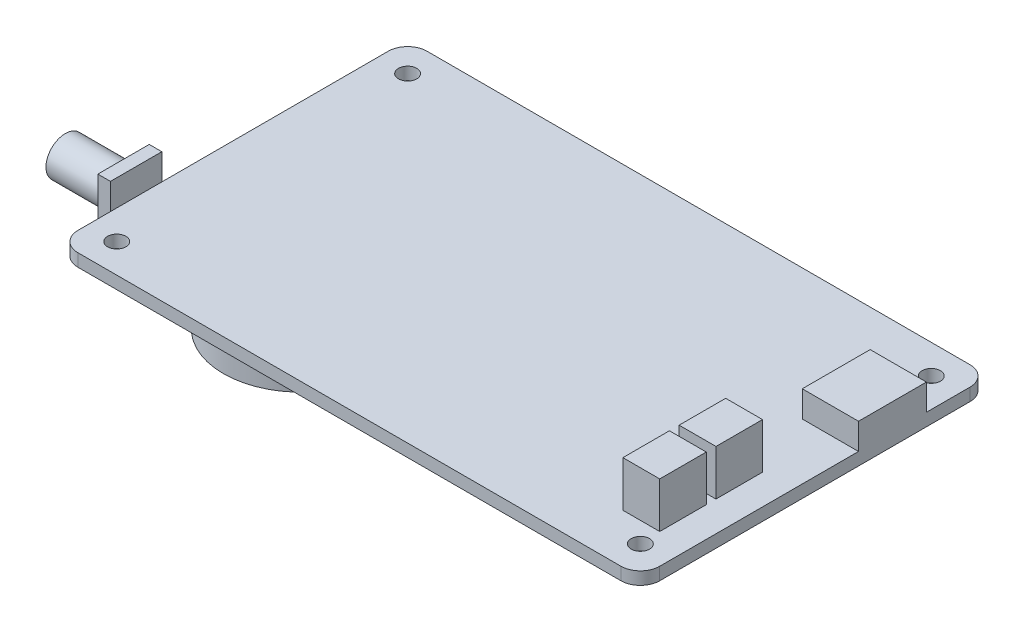
from build123d import *

# Parameters (mm, degrees)
SKETCH1_W                = 76.2
SKETCH1_H                = 45.72
BOSS_EXTRUDE1_DEPTH      = 0.8255
SKETCH2_R                = 10.16
BOSS_EXTRUDE2_DEPTH      = 5.08
SKETCH3_W                = 6.731
SKETCH3_H                = 6.858
BOSS_EXTRUDE3_DEPTH      = 1.651
SKETCH4_R                = 2.54
BOSS_EXTRUDE4_DEPTH      = 7.62
BOSS_EXTRUDE5_DEPTH      = 5.969
BOSS_EXTRUDE5_DEPTH_BACK = 2.54
SKETCH5_W                = 4.826
SKETCH5_H                = 6.096
SKETCH6_W                = 7.366
SKETCH6_H                = 8.89
BOSS_EXTRUDE6_DEPTH      = 3.429
M2_CLEARANCE_HOLE1_D     = 2.4
FILLET1_R                = 2.54


with BuildPart() as part:
    # Sketch1 → Boss-Extrude1 (new, symmetric)
    with BuildSketch(Plane(origin=(0, 0, 0), x_dir=(1, 0, 0), z_dir=(0, 1, 0))):
        Rectangle(SKETCH1_W, SKETCH1_H)
    extrude(amount=BOSS_EXTRUDE1_DEPTH, both=True)

    # Sketch2 → Boss-Extrude2 (add)
    with BuildSketch(Plane.XZ.offset(0.8255)):
        with Locations(Location((-19.05, 10.16, 0), (0, 0, 90))):
            Circle(SKETCH2_R)
    extrude(amount=BOSS_EXTRUDE2_DEPTH)

    # Sketch3 → Boss-Extrude3 (add)
    with BuildSketch(Plane.ZY.offset(38.1)):
        with Locations((12.7, 0.8255)):
            Rectangle(SKETCH3_W, SKETCH3_H)
    extrude(amount=BOSS_EXTRUDE3_DEPTH)

    # Sketch4 → Boss-Extrude4 (add)
    with BuildSketch(Plane.ZY.offset(39.751)):
        with Locations(Location((12.7, 0.8255, 0), (0, 0, 180))):
            Circle(SKETCH4_R)
    extrude(amount=BOSS_EXTRUDE4_DEPTH)

    # Sketch5 → Boss-Extrude5 (add, two sides: drawn at the far end of the back side and taken through both)
    with BuildSketch(Plane(origin=(0, 0.8255, 0), x_dir=(1, 0, 0), z_dir=(0, 1, 0)).offset(-BOSS_EXTRUDE5_DEPTH_BACK)):
        with Locations((31.75, -13.335)):
            Rectangle(SKETCH5_W, SKETCH5_H)
        with Locations((31.75, -5.969)):
            Rectangle(SKETCH5_W, SKETCH5_H)
    extrude(amount=BOSS_EXTRUDE5_DEPTH + BOSS_EXTRUDE5_DEPTH_BACK)

    # Sketch6 → Boss-Extrude6 (add)
    with BuildSketch(Plane(origin=(0, 0.8255, 0), x_dir=(1, 0, 0), z_dir=(0, 1, 0))):
        with Locations((34.417, 10.16)):
            Rectangle(SKETCH6_W, SKETCH6_H)
    extrude(amount=BOSS_EXTRUDE6_DEPTH)

    # M2 Clearance Hole1 (through all)
    with Locations(Plane(origin=(0, 0.8255, 0), x_dir=(1, 0, 0), z_dir=(0, 1, 0))):
        with Locations((-34.29, 19.05), (34.29, 19.05), (-34.29, -19.05), (34.29, -19.05)):
            Hole(M2_CLEARANCE_HOLE1_D / 2)

    # Fillet1
    fillet1_edges = [part.edges().sort_by_distance(p)[0] for p in [
        (38.1, 0, 22.86),
        (-38.1, 0, 22.86),
        (-38.1, 0, -22.86),
        (38.1, 0, -22.86),
    ]]
    fillet(fillet1_edges, radius=FILLET1_R)


solid = part.part
